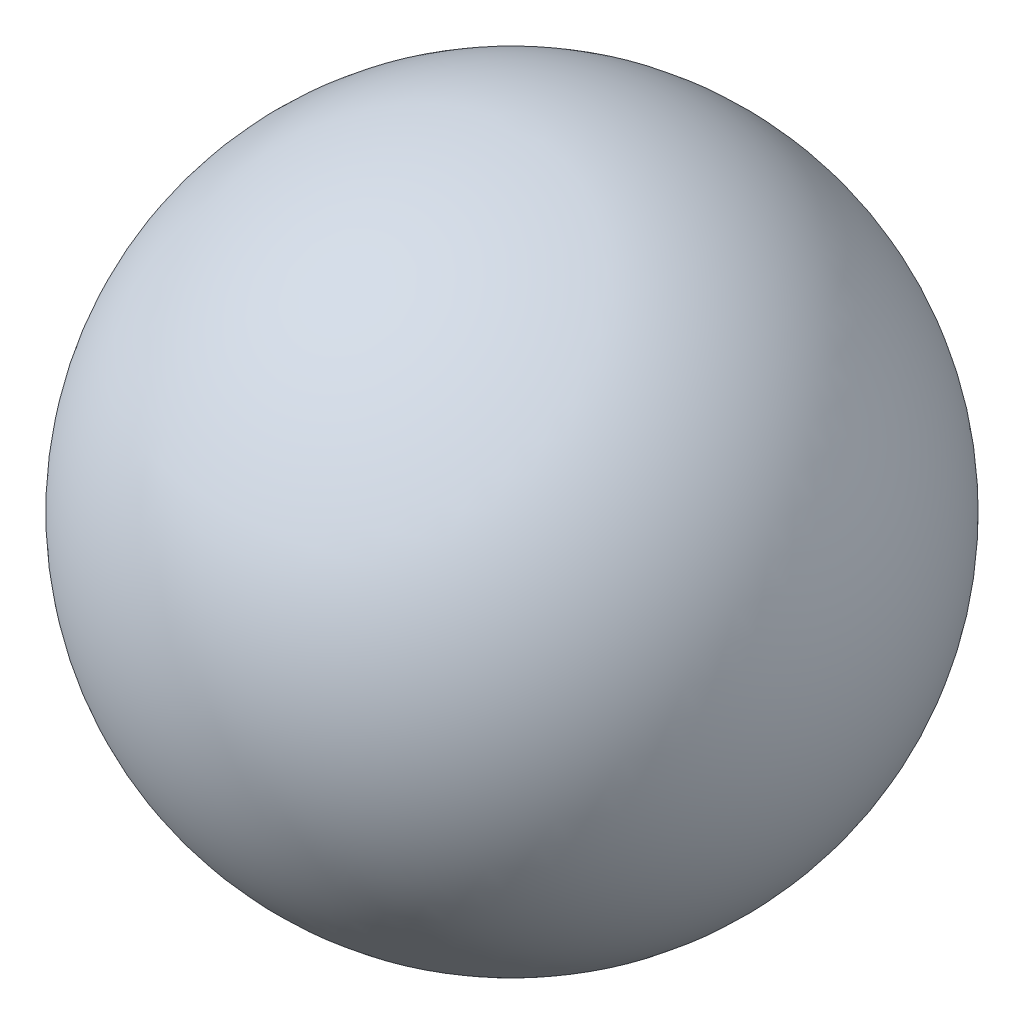
from build123d import *


with BuildPart() as part:
    # Sketch1 → Revolve6 (revolve)
    with BuildSketch(Plane.XY):
        with BuildLine():
            Line((0, 36.115188227), (0, -36.115188227))
            ThreePointArc((0, -36.115188227), (36.115188227, 0), (0, 36.115188227))
        make_face()
    revolve(axis=Axis((0, 0, 0), (0, 1, 0)))


solid = part.part
